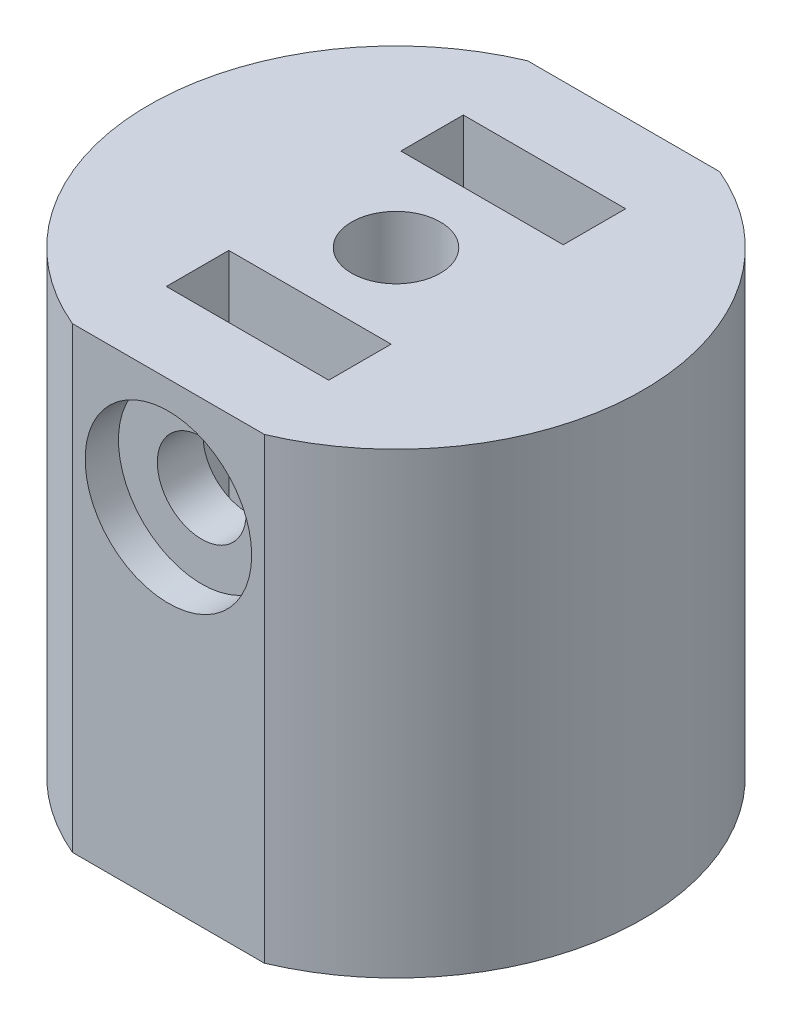
from build123d import *

# Parameters (mm, degrees)
ESQUISSE1_R             = 11.3
BOSS_EXTRU_1_DEPTH      = 16.5
ESQUISSE2_R             = 4.7
ENL_V_MAT_EXTRU_1_DEPTH = 1.5
ESQUISSE3_R             = 2.6
ENL_V_MAT_EXTRU_2_DEPTH = 3
ENL_V_MAT_EXTRU_3_DEPTH = 6
ESQUISSE5_R             = 1.6
ENL_V_MAT_EXTRU_4_DEPTH = 6.5
ESQUISSE6_W             = 5.85
ESQUISSE6_H             = 2.25
ENL_V_MAT_EXTRU_5_DEPTH = 8
ENL_V_START             = -3.1
ESQUISSE7_R             = 1.6
ENL_V_MAT_EXTRU_6_DEPTH = 28.74345755
ESQUISSE8_R             = 11.3
ENL_V_MAT_EXTRU_7_DEPTH = 23.970198254
ESQUISSE9_R             = 3
ENL_V_MAT_EXTRU_8_DEPTH = 1.2


with BuildPart() as part:
    # Esquisse1 → Boss.-Extru.1 (new body)
    with BuildSketch(Plane(origin=(0, 0, 0), x_dir=(1, 0, 0), z_dir=(0, 1, 0))):
        with Locations(Location((0, 0, 0), (0, 0, 270))):
            Circle(ESQUISSE1_R)
    extrude(amount=BOSS_EXTRU_1_DEPTH)

    # Esquisse2 → Enlèv. mat.-Extru.1 (cut)
    with BuildSketch(Plane.XZ):
        with Locations(Location((0, 0, 0), (0, 0, 270))):
            Circle(ESQUISSE2_R)
    extrude(amount=-ENL_V_MAT_EXTRU_1_DEPTH, mode=Mode.SUBTRACT)

    # Esquisse3 → Enlèv. mat.-Extru.2 (cut)
    with BuildSketch(Plane.XZ.offset(-1.5)):
        with Locations(Location((0, 0, 0), (0, 0, 270))):
            Circle(ESQUISSE3_R)
    extrude(amount=-ENL_V_MAT_EXTRU_2_DEPTH, mode=Mode.SUBTRACT)

    # Esquisse4 → Enlèv. mat.-Extru.3 (cut)
    with BuildSketch(Plane.XZ.offset(-4.5)):
        with BuildLine():
            Line((2.00935313, 1.65), (-2.00935313, 1.65))
            ThreePointArc((-2.00935313, 1.65), (-2.6, 0), (-2.00935313, -1.65))
            Line((-2.00935313, -1.65), (2.00935313, -1.65))
            ThreePointArc((2.00935313, -1.65), (2.447888696, -0.876265332), (2.6, 0))
            ThreePointArc((2.6, 0), (2.447888696, 0.876265332), (2.00935313, 1.65))
        make_face()
    extrude(amount=-ENL_V_MAT_EXTRU_3_DEPTH, mode=Mode.SUBTRACT)

    # Esquisse5 → Enlèv. mat.-Extru.4 (cut)
    with BuildSketch(Plane(origin=(0, 16.5, 0), x_dir=(1, 0, 0), z_dir=(0, 1, 0))):
        with Locations(Location((0, 0, 0), (0, 0, 270))):
            Circle(ESQUISSE5_R)
    extrude(amount=-ENL_V_MAT_EXTRU_4_DEPTH, mode=Mode.SUBTRACT)

    # Esquisse6 → Enlèv. mat.-Extru.5 (cut)
    with BuildSketch(Plane(origin=(0, 16.5, 0), x_dir=(1, 0, 0), z_dir=(0, 1, 0))):
        with Locations((0, -4.225)):
            Rectangle(ESQUISSE6_W, ESQUISSE6_H)
    enl_v_mat_extru_5 = extrude(amount=-ENL_V_MAT_EXTRU_5_DEPTH, mode=Mode.SUBTRACT)

    # Esquisse7 → Enlèv. mat.-Extru.6 (cut)
    with BuildSketch(Plane.XY.offset(3.1).offset(ENL_V_START)):
        with Locations(Location((0, 12.5, 0), (0, 0, 90))):
            Circle(ESQUISSE7_R)
    enl_v_mat_extru_6 = extrude(amount=ENL_V_MAT_EXTRU_6_DEPTH, mode=Mode.SUBTRACT)

    # Esquisse8 → Enlèv. mat.-Extru.7 (cut, through all)
    with BuildSketch(Plane(origin=(0, 16.5, 0), x_dir=(1, 0, 0), z_dir=(0, 1, 0))):
        Circle(ESQUISSE8_R)
        with BuildLine():
            Line((-3.459768778, -8.2), (3.459768778, -8.2))
            ThreePointArc((3.459768778, -8.2), (8.9, 0), (3.459768778, 8.2))
            Line((3.459768778, 8.2), (-3.459768778, 8.2))
            ThreePointArc((-3.459768778, 8.2), (-8.9, 0), (-3.459768778, -8.2))
        make_face(mode=Mode.SUBTRACT)
    extrude(amount=-ENL_V_MAT_EXTRU_7_DEPTH, mode=Mode.SUBTRACT)

    # Esquisse9 → Enlèv. mat.-Extru.8 (cut)
    with BuildSketch(Plane.XY.offset(8.2)):
        with Locations((0, 12.5)):
            Circle(ESQUISSE9_R)
    enl_v_mat_extru_8 = extrude(amount=-ENL_V_MAT_EXTRU_8_DEPTH, mode=Mode.SUBTRACT)

    # Symétrie1: Enlèv. mat.-Extru.5, Enlèv. mat.-Extru.6, Enlèv. mat.-Extru.8 across plane
    add(enl_v_mat_extru_5.mirror(Plane.XY), mode=Mode.SUBTRACT)
    add(enl_v_mat_extru_6.mirror(Plane.XY), mode=Mode.SUBTRACT)
    add(enl_v_mat_extru_8.mirror(Plane.XY), mode=Mode.SUBTRACT)


solid = part.part
